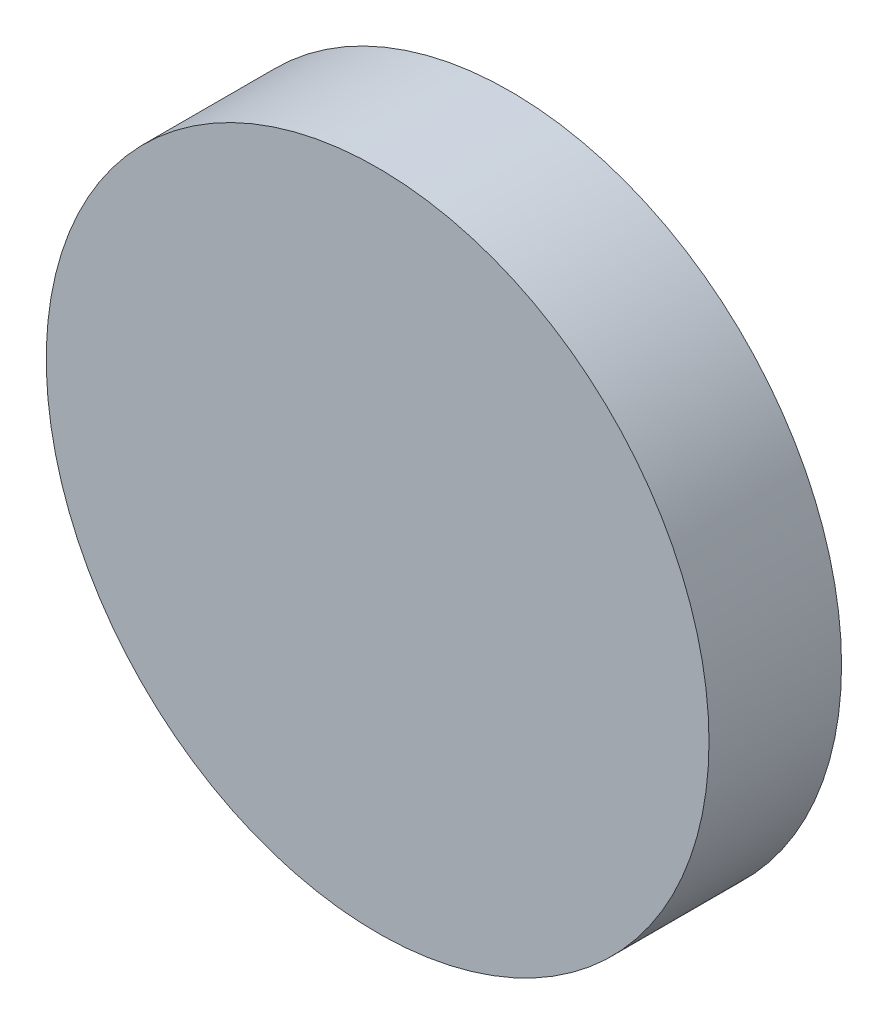
from build123d import *

# Parameters (mm, degrees)
SKETCH1_R           = 6.35
BOSS_EXTRUDE1_DEPTH = 2.54


with BuildPart() as part:
    # Sketch1 → Boss-Extrude1 (new body)
    with BuildSketch(Plane.XY):
        Circle(SKETCH1_R)
    extrude(amount=BOSS_EXTRUDE1_DEPTH)


solid = part.part
